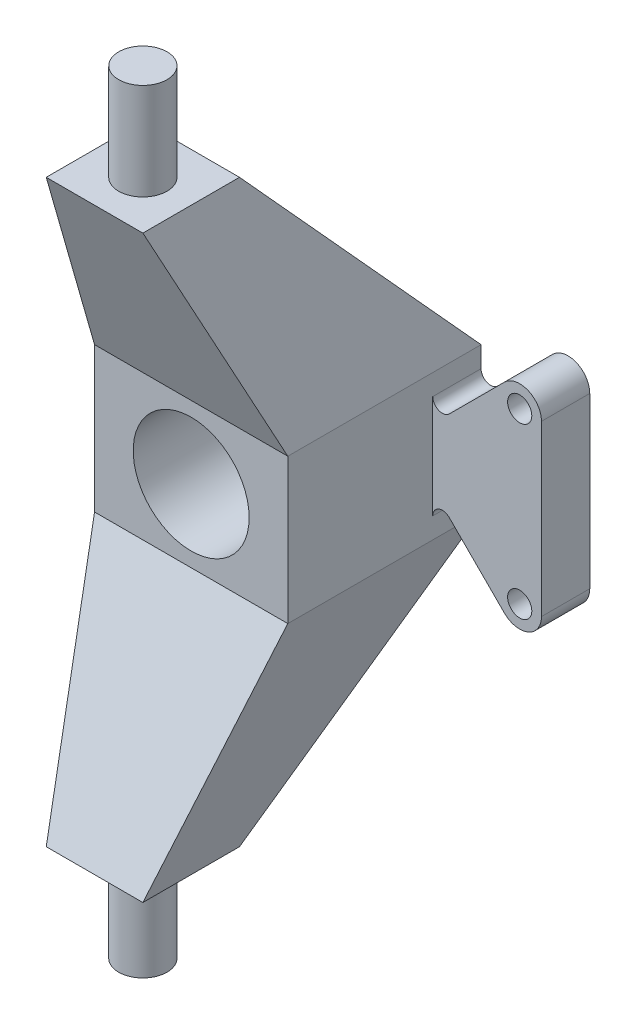
from build123d import *

# Parameters (mm, degrees)
ESQUISSE1_W        = 40
ESQUISSE1_H        = 30
ESQUISSE1_R        = 12
BOSS_EXTRU_1_DEPTH = 40
ESQUISSE3_R        = 5
BOSS_EXTRU_2_DEPTH = 20
ESQUISSE4_R        = 2.5
BOSS_EXTRU_3_DEPTH = 10
CONG_1_R           = 2
CONG_2_R           = 2


with BuildPart() as part:
    # Esquisse1 → Boss.-Extru.1 (new body)
    with BuildSketch(Plane.XY):
        Rectangle(ESQUISSE1_W, ESQUISSE1_H)
        Circle(ESQUISSE1_R, mode=Mode.SUBTRACT)
    extrude(amount=-BOSS_EXTRU_1_DEPTH)

    # Esquisse2 → section 0 of lissage1
    with BuildSketch(Plane(origin=(0, 60, 0), x_dir=(1, 0, 0), z_dir=(0, 1, 0)), mode=Mode.PRIVATE) as lissage1_s0:
        with BuildLine():
            Line((10, 0), (-10, 0))
            Line((-10, 0), (-10, -20))
            Line((-10, -20), (10, -20))
            Line((10, -20), (10, 0))
        make_face()
    # loft up to a face of the part (lissage1)
    loft([lissage1_s0.sketch, part.faces().sort_by_distance((0, 15, -20))[0]])

    # Esquisse3 → Boss.-Extru.2 (add)
    with BuildSketch(Plane(origin=(0, 60, 0), x_dir=(1, 0, 0), z_dir=(0, 1, 0))):
        with Locations(Location((0, -10, 0), (0, 0, 270))):
            Circle(ESQUISSE3_R)
    extrude(amount=BOSS_EXTRU_2_DEPTH)

    # Symétrie7: part across plane


with BuildPart() as part_1:
    add(part.part)
    add(part.part.mirror(Plane.ZX))

    # Esquisse4 → Boss.-Extru.3 (add)
    with BuildSketch(Plane(origin=(0, 0, -40), x_dir=(-1, 0, 0), z_dir=(0, 0, -1))):
        with BuildLine():
            Line((-20, 5.863961031), (-34.818019485, 20.681980515))
            ThreePointArc((-34.818019485, 20.681980515), (-39.722075446, 21.657457896), (-42.5, 17.5))
            Line((-42.5, 17.5), (-42.5, -17.5))
            ThreePointArc((-42.5, -17.5), (-39.722075446, -21.657457896), (-34.818019485, -20.681980515))
            Line((-34.818019485, -20.681980515), (-20, -5.863961031))
            Line((-20, -5.863961031), (-20, 5.863961031))
        make_face()
        with Locations((-38, 17.5)):
            Circle(ESQUISSE4_R, mode=Mode.SUBTRACT)
        with Locations((-38, -17.5)):
            Circle(ESQUISSE4_R, mode=Mode.SUBTRACT)
    extrude(amount=-BOSS_EXTRU_3_DEPTH)

    # Congé1
    cong_1_edges = [part_1.edges().sort_by_distance(p)[0] for p in [
        (20, 5.863961031, -35),
    ]]
    fillet(cong_1_edges, radius=CONG_1_R)

    # Congé2
    cong_2_edges = [part_1.edges().sort_by_distance(p)[0] for p in [
        (20, -5.863961031, -35),
    ]]
    fillet(cong_2_edges, radius=CONG_2_R)


solid = part_1.part
